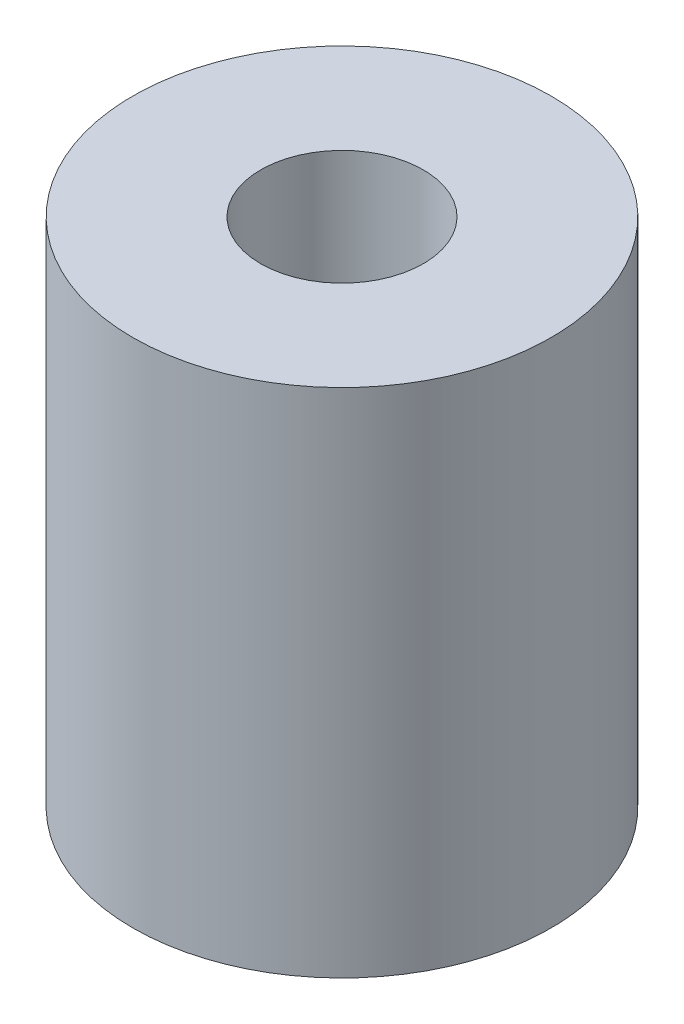
from build123d import *

# Parameters (mm, degrees)
SKETCH1_R           = 4.5
SKETCH1_R_2         = 1.75
BOSS_EXTRUDE1_DEPTH = 11


with BuildPart() as part:
    # Sketch1 → Boss-Extrude1 (new body)
    with BuildSketch(Plane(origin=(0, 0, 0), x_dir=(1, 0, 0), z_dir=(0, 1, 0))):
        with Locations(Location((0, 0, 0), (0, 0, 270))):
            Circle(SKETCH1_R)
        with Locations(Location((0, 0, 0), (0, 0, 270))):
            Circle(SKETCH1_R_2, mode=Mode.SUBTRACT)
    extrude(amount=BOSS_EXTRUDE1_DEPTH)


solid = part.part
